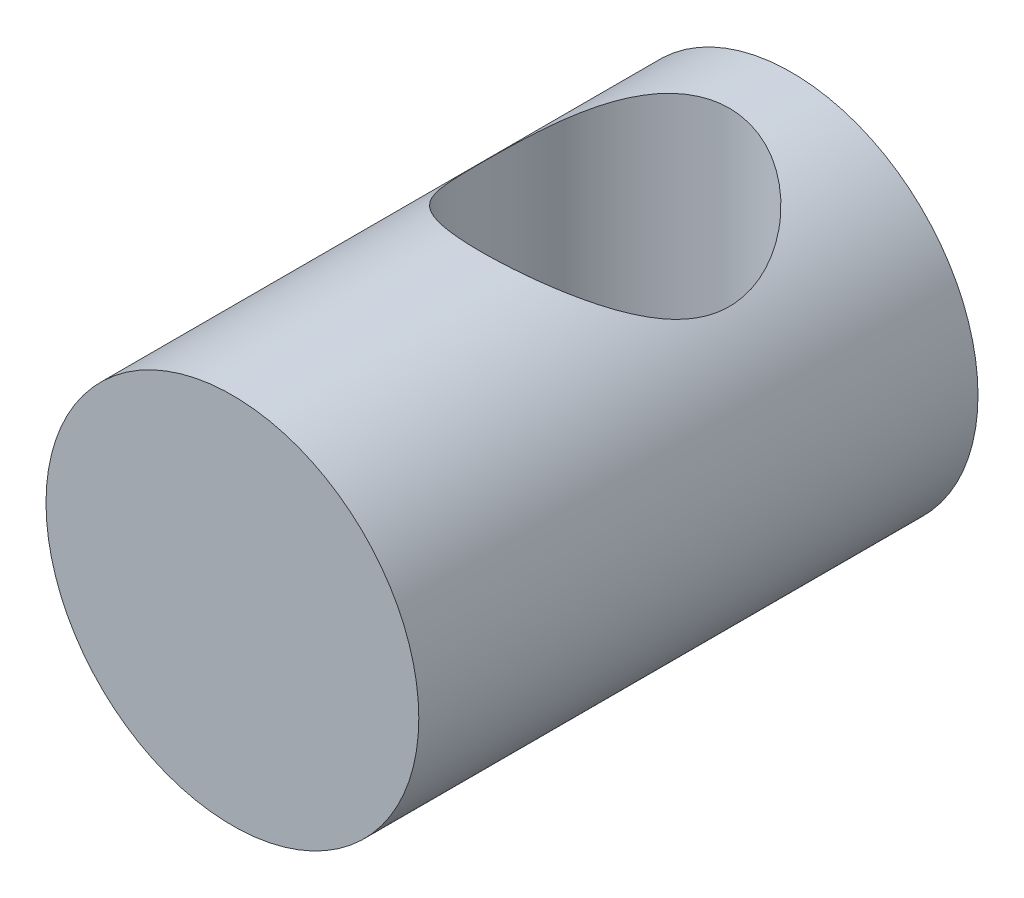
from build123d import *

# Parameters (mm, degrees)
SKETCH1_R           = 4.7625
BOSS_EXTRUDE1_DEPTH = 14.2875
SKETCH2_R           = 3.175
CUT_EXTRUDE1_DEPTH  = 7.14375


with BuildPart() as part:
    # Sketch1 → Boss-Extrude1 (new body)
    with BuildSketch(Plane.XY):
        Circle(SKETCH1_R)
    extrude(amount=-BOSS_EXTRUDE1_DEPTH)

    # Sketch2 → Cut-Extrude1 (cut, symmetric)
    with BuildSketch(Plane(origin=(0, 0, 0), x_dir=(1, 0, 0), z_dir=(0, 1, 0))):
        with Locations(Location((0, 9.525, 0), (0, 0, 90))):
            Circle(SKETCH2_R)
    extrude(amount=CUT_EXTRUDE1_DEPTH, both=True, mode=Mode.SUBTRACT)


solid = part.part
